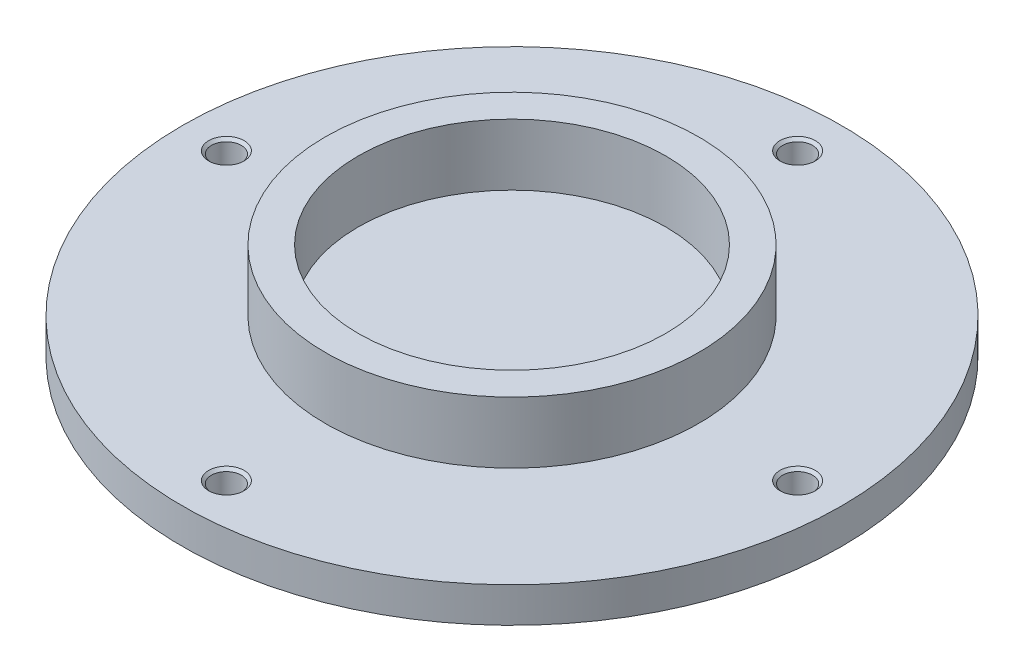
from build123d import *

# Parameters (mm, degrees)
HOLE_WIZARD_M8_1_D           = 6.8
HOLE_WIZARD_M8_1_CSINK_D     = 8.05
HOLE_WIZARD_M8_1_CSINK_ANGLE = 90


with BuildPart() as part:
    # 草图1 → 旋转1 (revolve)
    with BuildSketch(Plane.XY, mode=Mode.PRIVATE) as revolve_1_sk:
        Polygon((0, 0), (75, 0), (75, 8), (42.5, 8), (42.5, 22), (35, 22), (35, 8), (0, 8), align=None)
    revolve(revolve_1_sk.sketch.rotate(Axis((0, 8, 0), (0, -1, 0)), 180), axis=Axis((0, 8, 0), (0, -1, 0)))

    # M8 螺纹孔1 (through all)
    with Locations(Plane(origin=(0, 8, 0), x_dir=(1, 0, 0), z_dir=(0, 1, 0))):
        with Locations((-65, 0), (65, 0), (0, -65), (0, 65)):
            CounterSinkHole(HOLE_WIZARD_M8_1_D / 2, HOLE_WIZARD_M8_1_CSINK_D / 2, counter_sink_angle=HOLE_WIZARD_M8_1_CSINK_ANGLE)


solid = part.part
